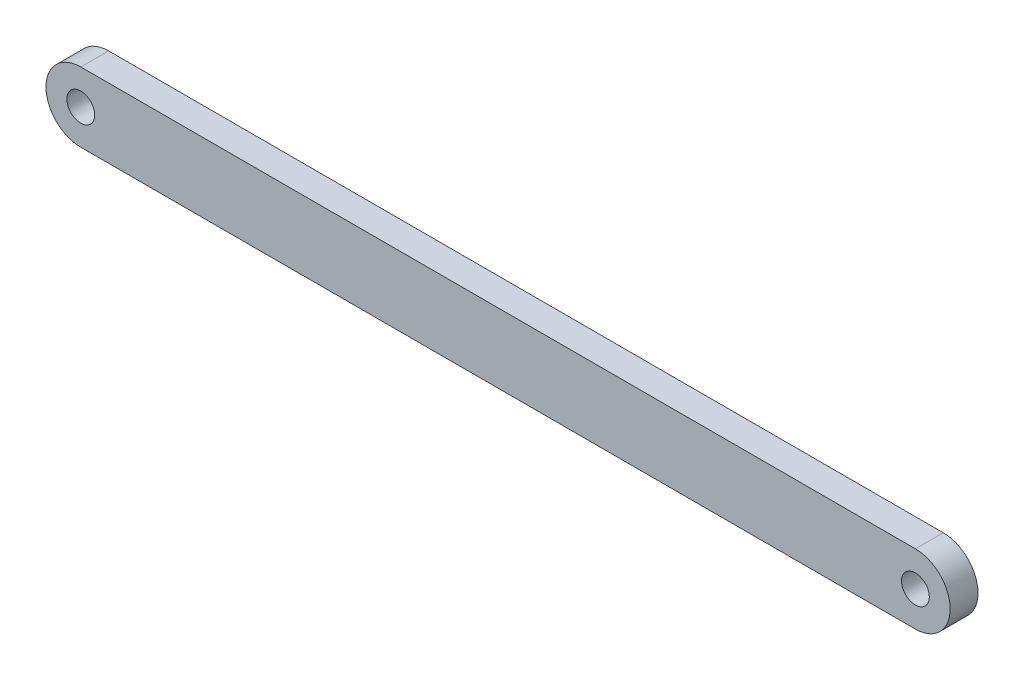
from build123d import *

# Parameters (mm, degrees)
SKETCH1_R           = 2
BOSS_EXTRUDE1_DEPTH = 4


with BuildPart() as part:
    # Sketch1 → Boss-Extrude1 (new body)
    with BuildSketch(Plane.XY):
        with BuildLine():
            Line((-60, -5), (60, -5))
            ThreePointArc((60, -5), (65, 0), (60, 5))
            Line((60, 5), (-60, 5))
            ThreePointArc((-60, 5), (-65, 0), (-60, -5))
        make_face()
        with Locations((60, 0)):
            Circle(SKETCH1_R, mode=Mode.SUBTRACT)
        with Locations((-60, 0)):
            Circle(SKETCH1_R, mode=Mode.SUBTRACT)
    extrude(amount=BOSS_EXTRUDE1_DEPTH)


solid = part.part
